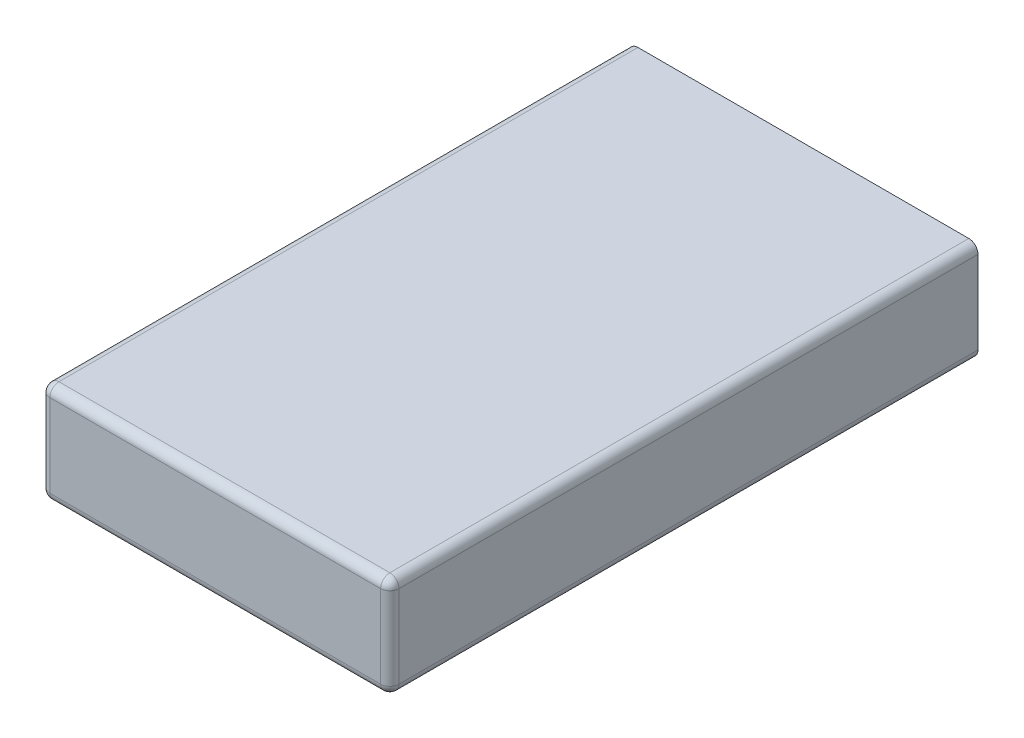
from build123d import *

# Parameters (mm, degrees)
SKETCH8_W           = 38
SKETCH8_H           = 11
SKETCH8_W_2         = 36.5
SKETCH8_H_2         = 9.5
BOSS_EXTRUDE2_DEPTH = 63
SKETCH9_W           = 38
SKETCH9_H           = 11
BOSS_EXTRUDE3_DEPTH = 1
FILLET1_R           = 1
FILLET2_R           = 1
FILLET3_R           = 1
FILLET4_R           = 1
FILLET5_R           = 1


with BuildPart() as part:
    # Sketch8 → Boss-Extrude2 (new body)
    with BuildSketch(Plane.XY):
        Rectangle(SKETCH8_W, SKETCH8_H)
        Rectangle(SKETCH8_W_2, SKETCH8_H_2, mode=Mode.SUBTRACT)
    extrude(amount=BOSS_EXTRUDE2_DEPTH)

    # Sketch9 → Boss-Extrude3 (add)
    with BuildSketch(Plane.XY.offset(63)):
        Rectangle(SKETCH9_W, SKETCH9_H)
    extrude(amount=BOSS_EXTRUDE3_DEPTH)

    # Fillet1
    fillet1_edges = [part.edges().sort_by_distance(p)[0] for p in [
        (-19, 5.5, 32),
    ]]
    fillet(fillet1_edges, radius=FILLET1_R)

    # Fillet2
    fillet2_edges = [part.edges().sort_by_distance(p)[0] for p in [
        (19, 5.5, 32),
    ]]
    fillet(fillet2_edges, radius=FILLET2_R)

    # Fillet3
    fillet3_edges = [part.edges().sort_by_distance(p)[0] for p in [
        (19, -5.5, 32),
    ]]
    fillet(fillet3_edges, radius=FILLET3_R)

    # Fillet4
    fillet4_edges = [part.edges().sort_by_distance(p)[0] for p in [
        (-19, -5.5, 32),
    ]]
    fillet(fillet4_edges, radius=FILLET4_R)

    # Fillet5
    fillet5_edges = [part.edges().sort_by_distance(p)[0] for p in [
        (-19, 0, 64),
        (-18.707106781, 5.207106781, 64),
        (0, 5.5, 64),
        (18.707106781, 5.207106781, 64),
        (19, 0, 64),
        (18.707106781, -5.207106781, 64),
        (0, -5.5, 64),
        (-18.707106781, -5.207106781, 64),
    ]]
    fillet(fillet5_edges, radius=FILLET5_R)


solid = part.part
